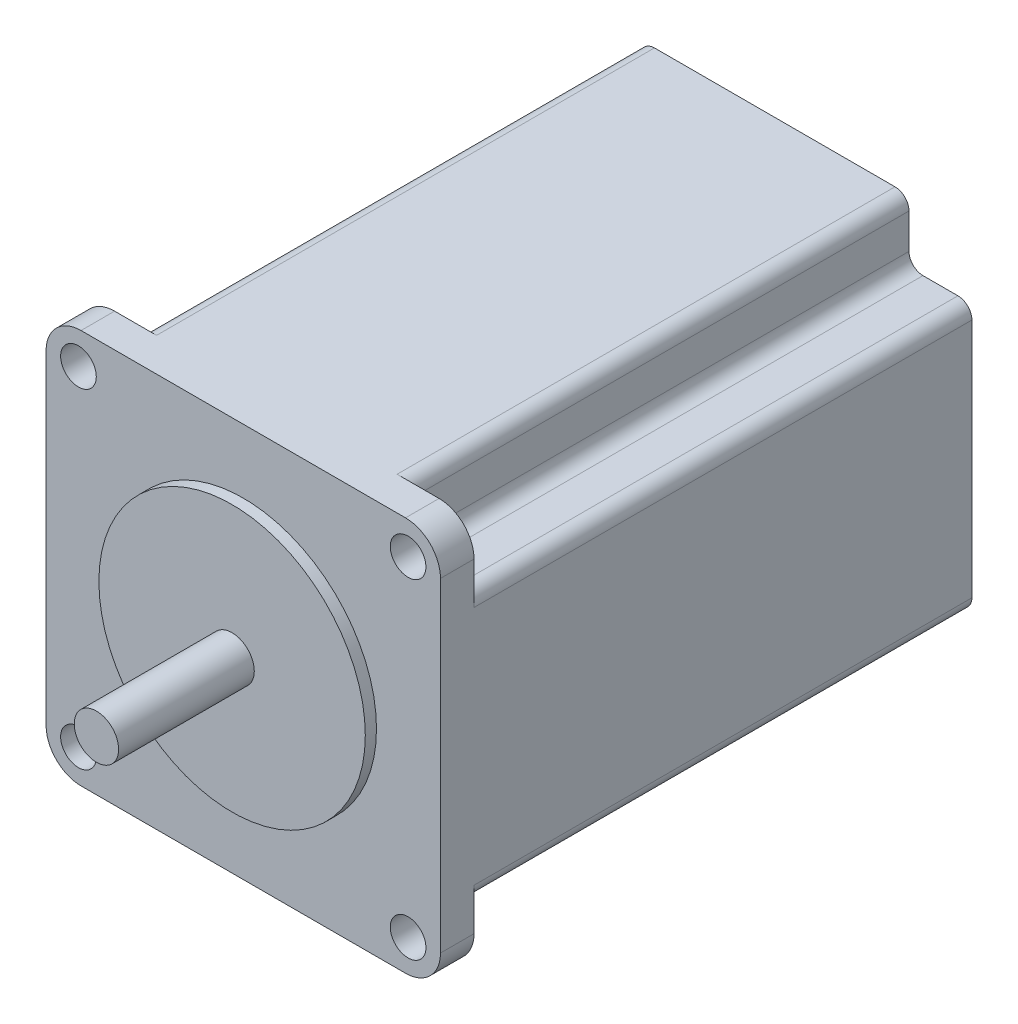
from build123d import *

# Parameters (mm, degrees)
EXTRUDE_1_DEPTH     = 76
SKETCH_2_R          = 19.05
EXTRUDE_2_DEPTH     = 1.6
SKETCH_3_OUTSIDE_W  = 80.656
SKETCH_3_OUTSIDE_H  = 80.656
CUT_EXTRUDE_1_DEPTH = 71.2
SKETCH_4_R          = 2.55
CUT_EXTRUDE_2_DEPTH = 71.2
SKETCH_5_R          = 3.175
EXTRUDE_3_DEPTH     = 19.4


with BuildPart() as part:
    # Эскиз1 → Бобышка-Вытянуть1 (new body)
    with BuildSketch(Plane.XY):
        with BuildLine():
            Line((5, 0), (51.4, 0))
            ThreePointArc((51.4, 0), (54.935533906, 1.464466094), (56.4, 5))
            Line((56.4, 5), (56.4, 51.4))
            ThreePointArc((56.4, 51.4), (54.935533906, 54.935533906), (51.4, 56.4))
            Line((51.4, 56.4), (5, 56.4))
            ThreePointArc((5, 56.4), (1.464466094, 54.935533906), (0, 51.4))
            Line((0, 51.4), (0, 5))
            ThreePointArc((0, 5), (1.464466094, 1.464466094), (5, 0))
        make_face()
    extrude(amount=EXTRUDE_1_DEPTH)

    # Эскиз2 → Бобышка-Вытянуть2 (add)
    with BuildSketch(Plane.XY.offset(76)):
        with Locations(Location((28.2, 28.2, 0), (0, 0, 180))):
            Circle(SKETCH_2_R)
    extrude(amount=EXTRUDE_2_DEPTH)

    # Эскиз3 outside → Вырез-Вытянуть1 (cut)
    with BuildSketch(Plane(origin=(0, 0, 0), x_dir=(-1, 0, 0), z_dir=(0, 0, -1))):
        with Locations((-28.2, 28.2)):
            Rectangle(SKETCH_3_OUTSIDE_W, SKETCH_3_OUTSIDE_H)
        with BuildLine():
            Line((-56.4, 11), (-56.4, 45.4))
            ThreePointArc((-56.4, 45.4), (-55.814213562, 46.814213562), (-54.4, 47.4))
            Line((-54.4, 47.4), (-49.4, 47.4))
            ThreePointArc((-49.4, 47.4), (-47.985786438, 47.985786438), (-47.4, 49.4))
            Line((-47.4, 49.4), (-47.4, 54.4))
            ThreePointArc((-47.4, 54.4), (-46.814213562, 55.814213562), (-45.4, 56.4))
            Line((-45.4, 56.4), (-11, 56.4))
            ThreePointArc((-11, 56.4), (-9.585786438, 55.814213562), (-9, 54.4))
            Line((-9, 54.4), (-9, 49.4))
            ThreePointArc((-9, 49.4), (-8.414213562, 47.985786438), (-7, 47.4))
            Line((-7, 47.4), (-2, 47.4))
            ThreePointArc((-2, 47.4), (-0.585786438, 46.814213562), (0, 45.4))
            Line((0, 45.4), (0, 11))
            ThreePointArc((0, 11), (-0.585786438, 9.585786438), (-2, 9))
            Line((-2, 9), (-7, 9))
            ThreePointArc((-7, 9), (-8.414213562, 8.414213562), (-9, 7))
            Line((-9, 7), (-9, 2))
            ThreePointArc((-9, 2), (-9.585786438, 0.585786438), (-11, 0))
            Line((-11, 0), (-45.4, 0))
            ThreePointArc((-45.4, 0), (-46.814213562, 0.585786438), (-47.4, 2))
            Line((-47.4, 2), (-47.4, 7))
            ThreePointArc((-47.4, 7), (-47.985786438, 8.414213562), (-49.4, 9))
            Line((-49.4, 9), (-54.4, 9))
            ThreePointArc((-54.4, 9), (-55.814213562, 9.585786438), (-56.4, 11))
        make_face(mode=Mode.SUBTRACT)
    extrude(amount=-CUT_EXTRUDE_1_DEPTH, mode=Mode.SUBTRACT)

    # Эскиз4 → Вырез-Вытянуть2 (cut)
    with BuildSketch(Plane.XY.offset(76)):
        with Locations((4.63, 51.77)):
            Circle(SKETCH_4_R)
        with Locations(Location((51.77, 51.77, 0), (0, 0, 180))):
            Circle(SKETCH_4_R)
        with Locations(Location((4.63, 4.63, 0), (0, 0, 180))):
            Circle(SKETCH_4_R)
        with Locations((51.77, 4.63)):
            Circle(SKETCH_4_R)
    extrude(amount=-CUT_EXTRUDE_2_DEPTH, mode=Mode.SUBTRACT)

    # Эскиз5 → Бобышка-Вытянуть3 (add)
    with BuildSketch(Plane.XY.offset(77.6)):
        with Locations((28.2, 28.2)):
            Circle(SKETCH_5_R)
    extrude(amount=EXTRUDE_3_DEPTH)


solid = part.part
